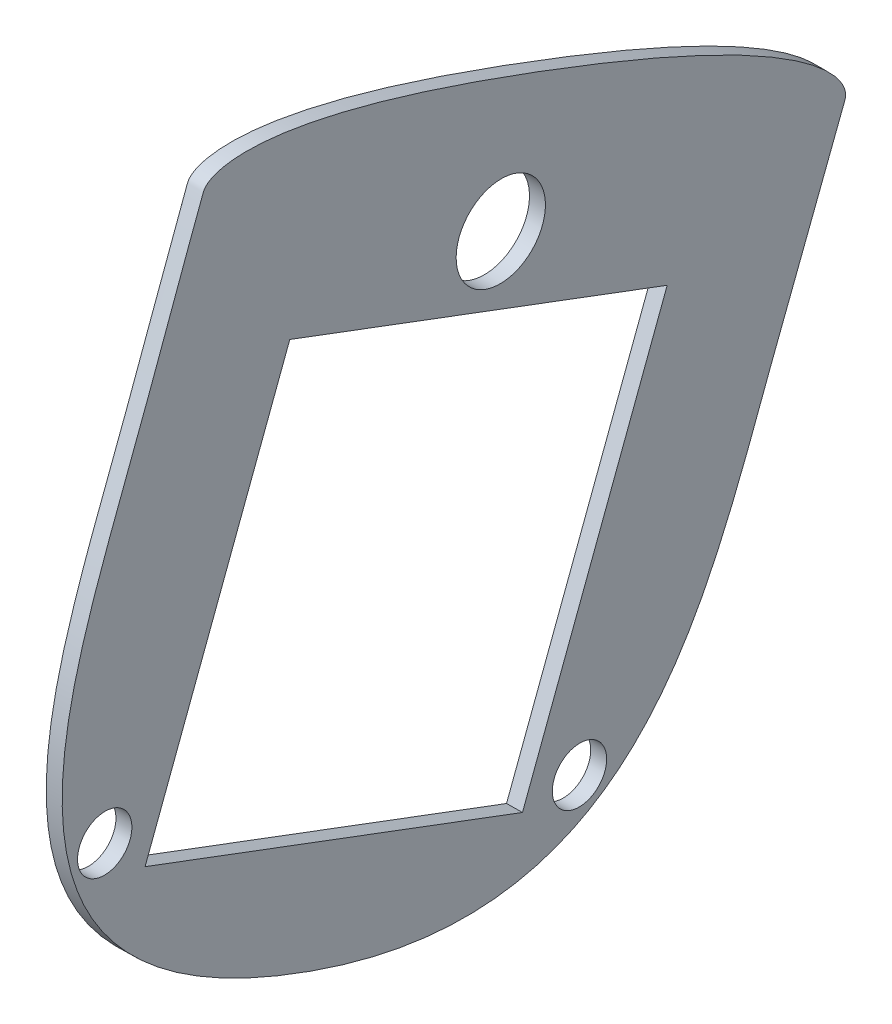
from build123d import *

# Parameters (mm, degrees)
SKETCH3_R           = 7
SKETCH3_R_2         = 11.5
BOSS_EXTRUDE1_DEPTH = 4


with BuildPart() as part:
    # Sketch3 → Boss-Extrude1 (new body)
    with BuildSketch(Plane(origin=(-1179.548631244, -0.000116963, 14.971959902), x_dir=(0.012691934504714668, 1.258519915397729e-09, 0.9999194541554475), z_dir=(-0.9999194541554426, -9.915104323779702e-08, 0.01269193450471473))):
        with BuildLine():
            add(Edge.make_bspline(
                [(79.731511359, 168.193238714), (79.653990348, 168.385028808), (79.560848033, 168.566952086), (79.340021847, 168.908981308), (79.210695298, 169.069519766), (78.781975606, 169.515640666), (78.453052752, 169.756433316), (77.746282808, 170.173760419), (77.374225273, 170.346957045), (76.618055792, 170.646037327), (76.231320865, 170.771825699), (75.445717635, 170.990086498), (75.045906717, 171.082888983), (74.247489576, 171.241412128), (73.847580027, 171.307196952), (72.646210891, 171.473011999), (71.843184122, 171.54291214), (69.429760333, 171.669106413), (67.815093888, 171.643318171), (64.579202467, 171.465649773), (62.967071145, 171.311986093), (59.761501008, 170.920602138), (58.165832493, 170.682336315), (54.984890477, 170.14361787), (53.399628362, 169.84309713), (48.656003205, 168.868782209), (45.506789421, 168.122733638), (39.249797793, 166.509066645), (36.140308585, 165.640552589), (29.948448592, 163.815519323), (26.866203634, 162.858591769), (17.650039352, 159.888600915), (11.545782566, 157.775383208), (-0.604884948, 153.379153881), (-6.649883911, 151.097259058), (-18.688554416, 146.4028894), (-24.680523881, 143.984731356), (-36.579086772, 138.946009306), (-42.48720288, 136.327283315), (-51.234098847, 132.155264206), (-54.130133676, 130.723161483), (-59.86339931, 127.745399278), (-62.701134229, 126.200213632), (-66.885552188, 123.757874778), (-68.267543958, 122.923061097), (-70.998671849, 121.200357071), (-72.348693773, 120.311881916), (-74.999405689, 118.465646948), (-76.299746495, 117.508671166), (-78.825235563, 115.49294562), (-80.049248813, 114.437694661), (-81.774889513, 112.738152296), (-82.332783613, 112.149849809), (-83.383569446, 110.929878833), (-83.877108359, 110.296939867), (-84.542674879, 109.293673656), (-84.751736662, 108.950032635), (-85.132145551, 108.235574011), (-85.304758407, 107.86235151), (-85.513078249, 107.289140179), (-85.574139308, 107.095376795), (-85.673359437, 106.700489416), (-85.711778268, 106.49784535), (-85.756696407, 106.092331571), (-85.763145275, 105.889424757), (-85.737523171, 105.483250415), (-85.703327234, 105.278262113), (-85.597830008, 104.884986791), (-85.523873758, 104.695924947), (-85.384388297, 104.314790942), (-85.314174304, 104.124392284), (-85.102076101, 103.553716505), (-84.958694223, 103.173974382), (-84.522670217, 102.036847892), (-84.22842153, 101.280037448), (-83.347304068, 99.009124064), (-82.757150372, 97.496255184), (-77.427867257, 83.887442151), (-72.568340001, 71.83882096), (-66.737069627, 56.682228052), (-65.584673582, 53.645435671), (-63.281283196, 47.571297248), (-62.126842023, 44.535312674), (-59.770964874, 38.48190606), (-58.570690945, 35.464025021), (-56.702609808, 30.963932613), (-56.068622936, 29.468362509), (-54.772277638, 26.488428815), (-54.10970721, 25.003530257), (-50.719177972, 17.634113766), (-47.758949004, 11.896808657), (-42.583210947, 3.760412983), (-40.736578387, 1.125788466), (-37.731278204, -2.675872465), (-36.690087096, -3.917919636), (-35.060433561, -5.737656238), (-34.50588785, -6.33700207), (-33.372447937, -7.520146808), (-32.792173192, -8.105241737), (-29.844081031, -10.971271048), (-27.345035113, -13.06656876), (-23.361138317, -15.878843088), (-21.993866388, -16.761036372), (-19.176922194, -18.409637683), (-17.726071397, -19.176623658), (-10.26634208, -22.700026264), (-3.982478372, -24.37756643), (3.372892879, -25.232130757), (4.192363049, -25.312442646), (5.826917129, -25.444456171), (6.643316249, -25.496315804), (9.090023055, -25.611760944), (10.717840409, -25.635216297), (15.592369686, -25.561797163), (18.83022132, -25.32214461), (23.672284231, -24.725550023), (25.283840676, -24.486970861), (28.502518986, -23.938352026), (30.111541063, -23.628043978), (34.919251683, -22.602553567), (38.086810794, -21.795332317), (44.362229463, -19.984607761), (47.470349167, -18.981959772), (52.094741262, -17.353749001), (53.629892226, -16.790255775), (56.688590576, -15.625118719), (58.212357435, -15.023644731), (62.749261915, -13.164082275), (65.732981199, -11.848923153), (71.605658244, -9.043722648), (74.494496152, -7.553460079), (80.153781675, -4.354445814), (82.925054017, -2.647216151), (86.970444464, 0.119434779), (88.300140209, 1.076287589), (90.262984087, 2.57006863), (90.911861108, 3.077716695), (92.191269416, 4.107787296), (92.822701791, 4.630874824), (95.936794113, 7.288238846), (98.290612927, 9.547936726), (101.576532204, 13.175794685), (102.63096678, 14.424867686), (104.14505095, 16.364251476), (104.638468156, 17.021690925), (105.601438789, 18.359800201), (106.070542909, 19.040099847), (108.332113692, 22.468634598), (109.891633942, 25.322744993), (112.496076731, 31.260270654), (113.539062393, 34.344548994), (114.516698545, 38.345205347), (114.695984749, 39.1532717), (115.019329007, 40.768087078), (115.163895258, 41.576748459), (115.548339076, 44.006342499), (115.738825401, 45.630895046), (116.131118547, 50.517683769), (116.153284335, 53.793085851), (115.932789324, 57.905529217), (115.87628302, 58.727799232), (115.740642557, 60.364293977), (115.661450805, 61.179677822), (115.392181665, 63.617848337), (115.170495378, 65.232675388), (114.395253364, 70.049410688), (113.731761037, 73.22363517), (112.186432981, 79.517101824), (111.303776376, 82.636137287), (109.395411477, 88.838185545), (108.367548146, 91.920655667), (106.214953417, 98.061203005), (105.08942372, 101.1201568), (102.790522474, 107.220318582), (101.616432384, 110.260954998), (99.260000539, 116.339064912), (98.081160798, 119.377880755), (95.751165053, 125.466123805), (94.599784894, 128.515458207), (91.164814026, 137.670501337), (88.904311415, 143.784882413), (85.499327305, 152.951121118), (84.361990555, 156.005652447), (82.644423664, 160.583097465), (82.069932146, 162.108171235), (81.204123694, 164.394249454), (80.91510568, 165.156119243), (80.479591411, 166.298175904), (80.33286847, 166.678277449), (80.10953366, 167.247206281), (79.997129382, 167.53139333), (79.883647323, 167.81517469), (79.80775605, 168.004273217), (79.770271865, 168.097343667), (79.731511359, 168.193238714)],
                knots=[0, 0, 0, 0, 0.000976562, 0.000976562, 0.001953125, 0.001953125, 0.00390625, 0.00390625, 0.005859375, 0.005859375, 0.0078125, 0.0078125, 0.009765625, 0.009765625, 0.01171875, 0.01171875, 0.015625, 0.015625, 0.0234375, 0.0234375, 0.03125, 0.03125, 0.0390625, 0.0390625, 0.046875, 0.046875, 0.0625, 0.0625, 0.078125, 0.078125, 0.09375, 0.09375, 0.125, 0.125, 0.15625, 0.15625, 0.1875, 0.1875, 0.21875, 0.21875, 0.234375, 0.234375, 0.25, 0.25, 0.2578125, 0.2578125, 0.265625, 0.265625, 0.2734375, 0.2734375, 0.28125, 0.28125, 0.28515625, 0.28515625, 0.2890625, 0.2890625, 0.291015625, 0.291015625, 0.29296875, 0.29296875, 0.293945312, 0.293945312, 0.294921875, 0.294921875, 0.295898437, 0.295898437, 0.296875, 0.296875, 0.297851562, 0.297851562, 0.298828125, 0.298828125, 0.30078125, 0.30078125, 0.3046875, 0.3046875, 0.3125, 0.3125, 0.375, 0.375, 0.390625, 0.390625, 0.40625, 0.40625, 0.421875, 0.421875, 0.4296875, 0.4296875, 0.4375, 0.4375, 0.46875, 0.46875, 0.484375, 0.484375, 0.4921875, 0.4921875, 0.49609375, 0.49609375, 0.5, 0.5, 0.515625, 0.515625, 0.5234375, 0.5234375, 0.53125, 0.53125, 0.5625, 0.5625, 0.56640625, 0.56640625, 0.5703125, 0.5703125, 0.578125, 0.578125, 0.59375, 0.59375, 0.6015625, 0.6015625, 0.609375, 0.609375, 0.625, 0.625, 0.640625, 0.640625, 0.6484375, 0.6484375, 0.65625, 0.65625, 0.671875, 0.671875, 0.6875, 0.6875, 0.703125, 0.703125, 0.7109375, 0.7109375, 0.71484375, 0.71484375, 0.71875, 0.71875, 0.734375, 0.734375, 0.7421875, 0.7421875, 0.74609375, 0.74609375, 0.75, 0.75, 0.765625, 0.765625, 0.78125, 0.78125, 0.78515625, 0.78515625, 0.7890625, 0.7890625, 0.796875, 0.796875, 0.8125, 0.8125, 0.81640625, 0.81640625, 0.8203125, 0.8203125, 0.828125, 0.828125, 0.84375, 0.84375, 0.859375, 0.859375, 0.875, 0.875, 0.890625, 0.890625, 0.90625, 0.90625, 0.921875, 0.921875, 0.9375, 0.9375, 0.96875, 0.96875, 0.984375, 0.984375, 0.9921875, 0.9921875, 0.99609375, 0.99609375, 0.998046875, 0.998046875, 0.999023437, 0.999511719, 0.999511719, 1, 1, 1, 1], degree=3))
        make_face()
        with Locations((-17.186648299, -9.215855238)):
            Circle(SKETCH3_R, mode=Mode.SUBTRACT)
        Polygon((94.736446449, 27.279702875), (-2.498711879, -10.009217528), (-39.787632282, 87.2259408), (57.447526046, 124.514861203), align=None, mode=Mode.SUBTRACT)
        with Locations((105.127599262, 37.690699139)):
            Circle(SKETCH3_R, mode=Mode.SUBTRACT)
        with Locations((3.088369787, 120.842225121)):
            Circle(SKETCH3_R_2, mode=Mode.SUBTRACT)
    extrude(amount=-BOSS_EXTRUDE1_DEPTH)


solid = part.part
